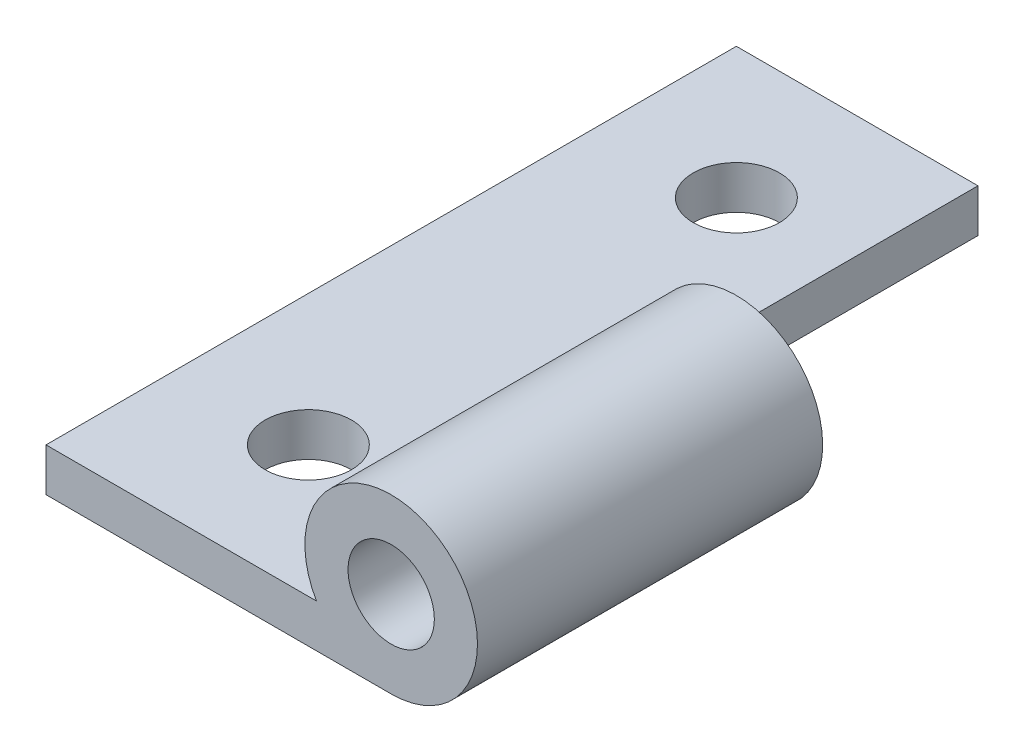
from build123d import *

# Parameters (mm, degrees)
BOSS_EXTRUDE1_DEPTH = 12.7
SKETCH2_W           = 8.89
SKETCH2_H           = 1.5875
BOSS_EXTRUDE2_DEPTH = 12.7
SKETCH3_R           = 1.5875
CUT_EXTRUDE1_DEPTH  = 17.78


with BuildPart() as part:
    # Sketch1 → Boss-Extrude1 (new body)
    # profile 1 of 3: a face of its own
    with BuildSketch(Plane.XY):
        with BuildLine():
            ThreePointArc((0, -1.5875), (-1.5875, -1.162130657), (-2.749630657, 0))
            Line((-2.749630657, 0), (-12.7, 0))
            Line((-12.7, 0), (-12.7, -1.5875))
            Line((-12.7, -1.5875), (0, -1.5875))
        make_face()
    # profile 2 of 3: a face of its own
    with BuildSketch(Plane.XY):
        with BuildLine():
            Line((0, -1.5875), (0, 0))
            Line((0, 0), (-2.749630657, 0))
            ThreePointArc((-2.749630657, 0), (-1.5875, -1.162130657), (0, -1.5875))
        make_face()
    # profile 3 of 3: a face of its own
    with BuildSketch(Plane.XY):
        with BuildLine():
            Line((-2.749630657, 0), (0, 0))
            Line((0, 0), (0, -1.5875))
            ThreePointArc((0, -1.5875), (2.24506403, -0.65756403), (3.175, 1.5875))
            ThreePointArc((3.175, 1.5875), (-0.821750468, 4.654314498), (-2.749630657, 0))
        make_face()
        with BuildLine():
            ThreePointArc((1.5875, 1.5875), (1.122532015, 0.464967985), (0, 0))
            ThreePointArc((0, 0), (-1.122532015, 2.710032015), (1.5875, 1.5875))
        make_face(mode=Mode.SUBTRACT)
    extrude(amount=BOSS_EXTRUDE1_DEPTH)

    # Sketch2 → Boss-Extrude2 (add)
    with BuildSketch(Plane(origin=(0, 0, 0), x_dir=(-1, 0, 0), z_dir=(0, 0, -1))):
        with Locations((8.255, -0.79375)):
            Rectangle(SKETCH2_W, SKETCH2_H)
    extrude(amount=BOSS_EXTRUDE2_DEPTH)

    # Sketch3 → Cut-Extrude1 (cut)
    with BuildSketch(Plane(origin=(0, 0, 0), x_dir=(1, 0, 0), z_dir=(0, 1, 0))):
        with Locations(Location((-7.874, 7.874, 0), (0, 0, 180))):
            Circle(SKETCH3_R)
        with Locations(Location((-7.874, -7.874, 0), (0, 0, 180))):
            Circle(SKETCH3_R)
    extrude(amount=-CUT_EXTRUDE1_DEPTH, mode=Mode.SUBTRACT)


solid = part.part
